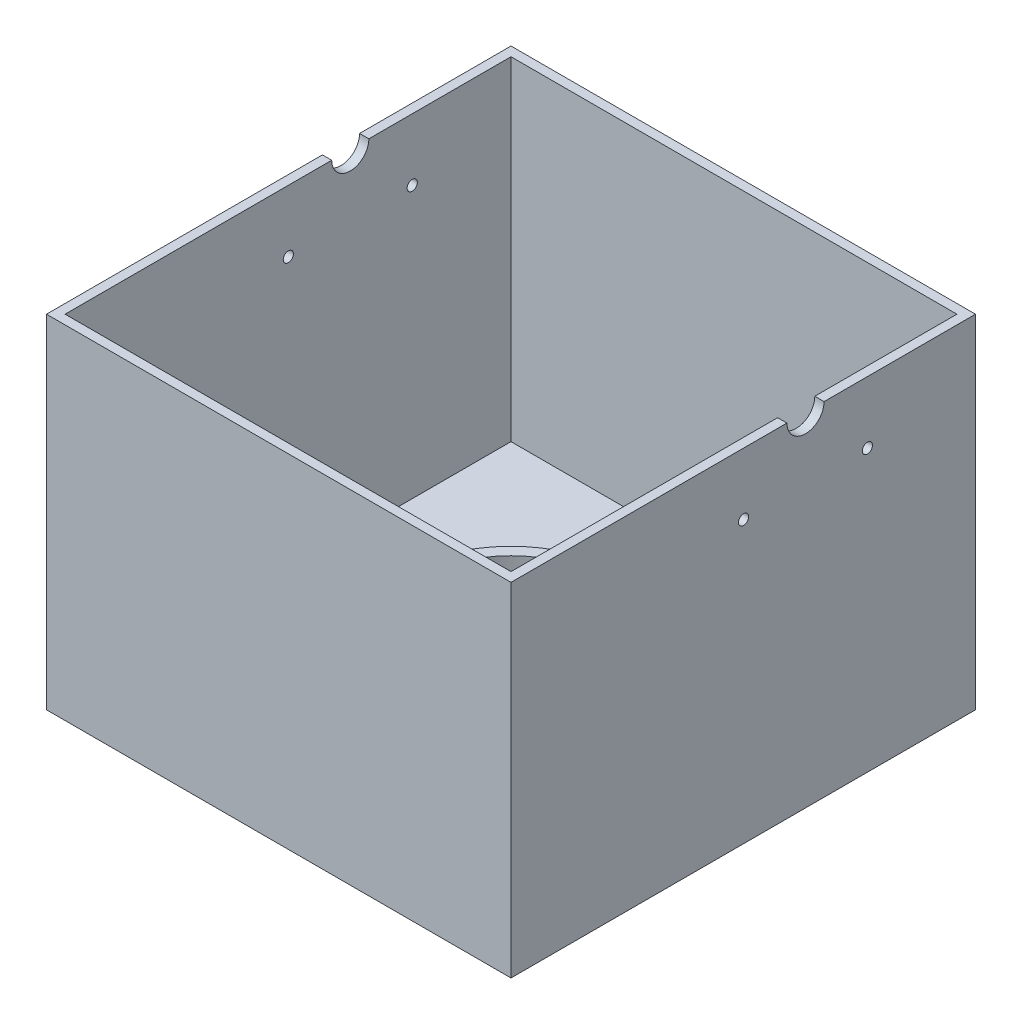
from build123d import *

# Parameters (mm, degrees)
SKETCH_1_W          = 150
SKETCH_1_H          = 150
EXTRUDE_1_DEPTH     = 3
SKETCH_2_W          = 150
SKETCH_2_H          = 150
SKETCH_2_W_2        = 144
SKETCH_2_H_2        = 144
EXTRUDE_2_DEPTH     = 107.65
SKETCH_3_R          = 31.25
CUT_EXTRUDE_1_DEPTH = 91
SKETCH_4_R          = 6
CUT_EXTRUDE_2_DEPTH = 201.9189451
SKETCH_8_R          = 35
SKETCH_8_R_2        = 31.25
EXTRUDE_4_DEPTH     = 18
SKETCH_9_R          = 1.65
CUT_EXTRUDE_3_DEPTH = 201.9189451
EXTRUDE_START       = 27
SKETCH_14_R         = 35
SKETCH_14_R_2       = 31.25
EXTRUDE_7_DEPTH     = 27
SKETCH_15_R         = 31.25
SKETCH_15_R_2       = 27.5
EXTRUDE_8_DEPTH     = 3


with BuildPart() as part:
    # 草图1 → 凸台-拉伸1 (new body)
    with BuildSketch(Plane(origin=(0, 0, 0), x_dir=(1, 0, 0), z_dir=(0, 1, 0))):
        Rectangle(SKETCH_1_W, SKETCH_1_H)
    extrude(amount=EXTRUDE_1_DEPTH)

    # 草图2 → 凸台-拉伸2 (add)
    with BuildSketch(Plane(origin=(0, 3, 0), x_dir=(1, 0, 0), z_dir=(0, 1, 0))):
        Rectangle(SKETCH_2_W, SKETCH_2_H)
        Rectangle(SKETCH_2_W_2, SKETCH_2_H_2, mode=Mode.SUBTRACT)
    extrude(amount=EXTRUDE_2_DEPTH)

    # 草图3 → 切除-拉伸1 (cut)
    with BuildSketch(Plane.XZ):
        with Locations(Location((0, 0, 0), (0, 0, 270))):
            Circle(SKETCH_3_R)
    extrude(amount=-CUT_EXTRUDE_1_DEPTH, mode=Mode.SUBTRACT)

    # 草图4 → 切除-拉伸2 (cut, through all)
    with BuildSketch(Plane.ZY.offset(75)):
        with Locations((-20.1, 110.65)):
            Circle(SKETCH_4_R)
    extrude(amount=-CUT_EXTRUDE_2_DEPTH, mode=Mode.SUBTRACT)

    # 草图8 → 凸台-拉伸4 (add)
    with BuildSketch(Plane(origin=(0, 3, 0), x_dir=(1, 0, 0), z_dir=(0, 1, 0))):
        with Locations(Location((0, 0, 0), (0, 0, 270))):
            Circle(SKETCH_8_R)
        with Locations(Location((0, 0, 0), (0, 0, 90))):
            Circle(SKETCH_8_R_2, mode=Mode.SUBTRACT)
    extrude(amount=EXTRUDE_4_DEPTH)

    # 草图9 → 切除-拉伸3 (cut, through all)
    with BuildSketch(Plane.ZY.offset(75)):
        with Locations((-40.1, 90.65)):
            Circle(SKETCH_9_R)
        with Locations((-0.1, 90.65)):
            Circle(SKETCH_9_R)
    extrude(amount=-CUT_EXTRUDE_3_DEPTH, mode=Mode.SUBTRACT)

    # 草图14 → 凸台-拉伸7 (add)
    with BuildSketch(Plane.XZ.offset(EXTRUDE_START)):
        with Locations(Location((0, 0, 0), (0, 0, 90))):
            Circle(SKETCH_14_R)
        with Locations(Location((0, 0, 0), (0, 0, 270))):
            Circle(SKETCH_14_R_2, mode=Mode.SUBTRACT)
    extrude(amount=-EXTRUDE_7_DEPTH)

    # 草图15 → 凸台-拉伸8 (add)
    with BuildSketch(Plane.XZ.offset(27)):
        with Locations(Location((0, 0, 0), (0, 0, 270))):
            Circle(SKETCH_15_R)
        with Locations(Location((0, 0, 0), (0, 0, 270))):
            Circle(SKETCH_15_R_2, mode=Mode.SUBTRACT)
    extrude(amount=-EXTRUDE_8_DEPTH)


solid = part.part
